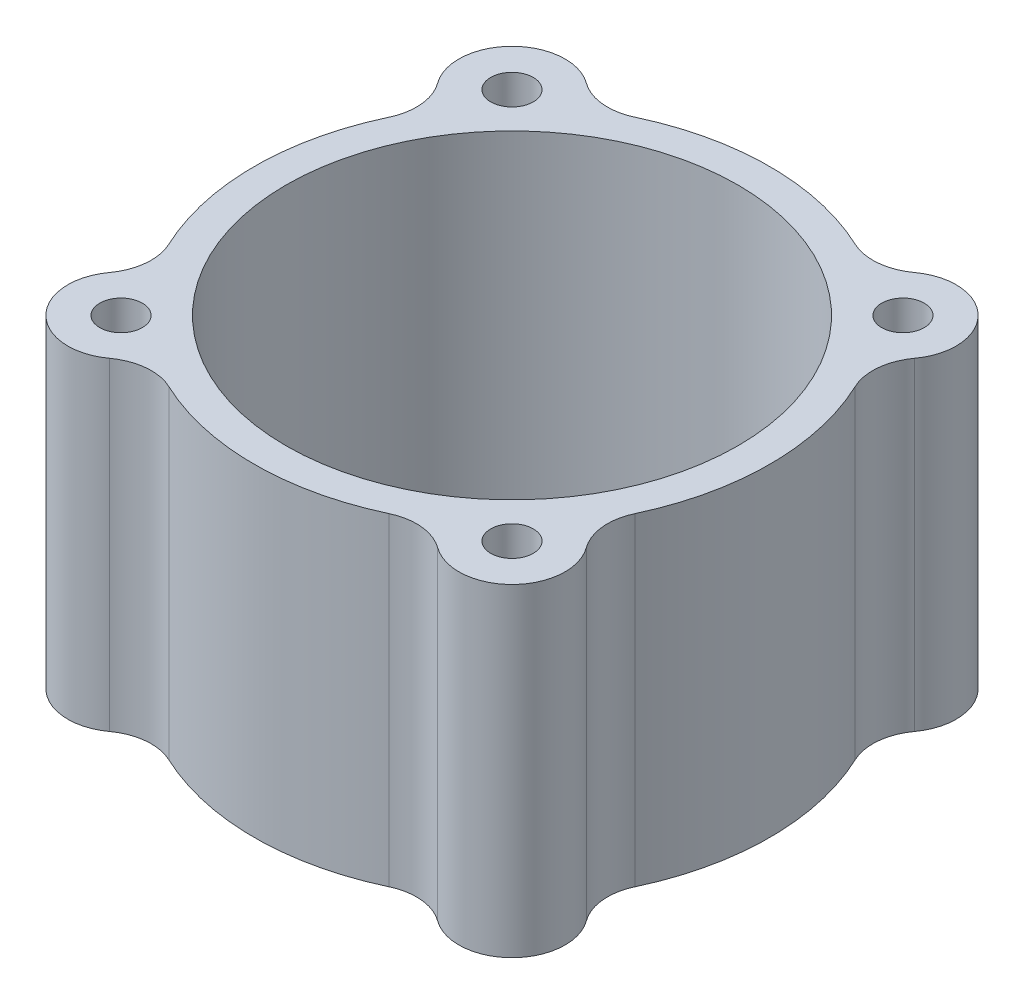
from build123d import *

# Parameters (mm, degrees)
SKETCH1_R           = 21.25
SKETCH1_R_2         = 2
BOSS_EXTRUDE1_DEPTH = 30.4


with BuildPart() as part:
    # Sketch1 → Boss-Extrude1 (new body)
    with BuildSketch(Plane(origin=(0, 0, 0), x_dir=(1, 0, 0), z_dir=(0, 1, 0))):
        with BuildLine():
            ThreePointArc((-15.431825442, 22.419634577), (-21.920310245, 21.920310245), (-22.419634577, 15.431825442))
            ThreePointArc((-22.419634577, 15.431825442), (-21.477282941, 12.955720303), (-21.932357291, 10.345733597))
            ThreePointArc((-21.932357291, 10.345733597), (-24.25, 0), (-21.932357291, -10.345733597))
            ThreePointArc((-21.932357291, -10.345733597), (-21.477282941, -12.955720303), (-22.419634577, -15.431825442))
            ThreePointArc((-22.419634577, -15.431825442), (-21.920310245, -21.920310245), (-15.431825442, -22.419634577))
            ThreePointArc((-15.431825442, -22.419634577), (-12.955720303, -21.477282941), (-10.345733597, -21.932357291))
            ThreePointArc((-10.345733597, -21.932357291), (0, -24.25), (10.345733597, -21.932357291))
            ThreePointArc((10.345733597, -21.932357291), (12.955720303, -21.477282941), (15.431825442, -22.419634577))
            ThreePointArc((15.431825442, -22.419634577), (21.920310245, -21.920310245), (22.419634577, -15.431825442))
            ThreePointArc((22.419634577, -15.431825442), (21.477282941, -12.955720303), (21.932357291, -10.345733597))
            ThreePointArc((21.932357291, -10.345733597), (24.25, 0), (21.932357291, 10.345733597))
            ThreePointArc((21.932357291, 10.345733597), (21.477282941, 12.955720303), (22.419634577, 15.431825442))
            ThreePointArc((22.419634577, 15.431825442), (21.920310245, 21.920310245), (15.431825442, 22.419634577))
            ThreePointArc((15.431825442, 22.419634577), (12.955720303, 21.477282941), (10.345733597, 21.932357291))
            ThreePointArc((10.345733597, 21.932357291), (0, 24.25), (-10.345733597, 21.932357291))
            ThreePointArc((-10.345733597, 21.932357291), (-12.955720303, 21.477282941), (-15.431825442, 22.419634577))
        make_face()
        with Locations(Location((0, 0, 0), (0, 0, 90))):
            Circle(SKETCH1_R, mode=Mode.SUBTRACT)
        with Locations(Location((-18.384776339, 18.384776339, 0), (0, 0, 90))):
            Circle(SKETCH1_R_2, mode=Mode.SUBTRACT)
        with Locations(Location((18.384776339, 18.384776339, 0), (0, 0, 90))):
            Circle(SKETCH1_R_2, mode=Mode.SUBTRACT)
        with Locations(Location((18.384776339, -18.384776339, 0), (0, 0, 90))):
            Circle(SKETCH1_R_2, mode=Mode.SUBTRACT)
        with Locations(Location((-18.384776339, -18.384776339, 0), (0, 0, 90))):
            Circle(SKETCH1_R_2, mode=Mode.SUBTRACT)
    extrude(amount=BOSS_EXTRUDE1_DEPTH)


solid = part.part
